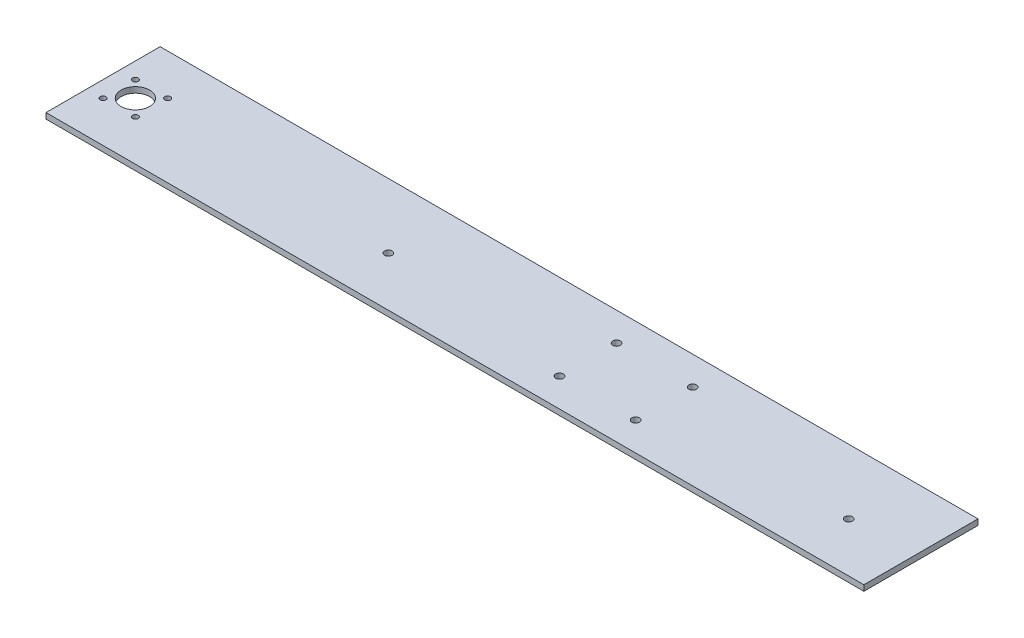
from build123d import *

# Parameters (mm, degrees)
SKETCH1_W                 = 430
SKETCH1_H                 = 60
BOSS_EXTRUDE1_DEPTH       = 3
OTW_R_POD_RUB_M41_D       = 4
SKETCH4_R                 = 7.5
CUT_EXTRUDE1_DEPTH        = 5
F_3_0MM_DOWEL_HOLE1_D     = 3
F_3_0MM_DOWEL_HOLE1_DEPTH = 6
F_3_0MM_DOWEL_HOLE1_TIP   = 0.901290929


with BuildPart() as part:
    # Sketch1 → Boss-Extrude1 (new body)
    with BuildSketch(Plane(origin=(0, 0, 0), x_dir=(1, 0, 0), z_dir=(0, 1, 0))):
        with Locations((85, 30)):
            Rectangle(SKETCH1_W, SKETCH1_H)
    extrude(amount=BOSS_EXTRUDE1_DEPTH)

    # Otwór pod śrubę M41 (through all)
    with Locations(Plane(origin=(0, 3, 0), x_dir=(1, 0, 0), z_dir=(0, 1, 0))):
        with Locations((266, 26), (24, 26), (125, 15), (165, 15), (165, 45), (125, 45)):
            Hole(OTW_R_POD_RUB_M41_D / 2)

    # Sketch4 → Cut-Extrude1 (cut)
    with BuildSketch(Plane(origin=(0, 3, 0), x_dir=(1, 0, 0), z_dir=(0, 1, 0))):
        with Locations(Location((-113, 30, 0), (0, 0, 270))):
            Circle(SKETCH4_R)
    extrude(amount=-CUT_EXTRUDE1_DEPTH, mode=Mode.SUBTRACT)

    # Ø3.0mm Dowel Hole1
    with Locations(Plane(origin=(0, 3, 0), x_dir=(1, 0, 0), z_dir=(0, 1, 0))):
        with Locations((-121.485281374, 21.514718626), (-121.485281374, 38.485281374), (-104.514718626, 21.514718626), (-104.514718626, 38.485281374)):
            Hole(F_3_0MM_DOWEL_HOLE1_D / 2, depth=F_3_0MM_DOWEL_HOLE1_DEPTH)
            with Locations((0, 0, -(F_3_0MM_DOWEL_HOLE1_DEPTH + F_3_0MM_DOWEL_HOLE1_TIP / 2))):  # 118° drill point
                Cone(0, F_3_0MM_DOWEL_HOLE1_D / 2, F_3_0MM_DOWEL_HOLE1_TIP, mode=Mode.SUBTRACT)


solid = part.part
